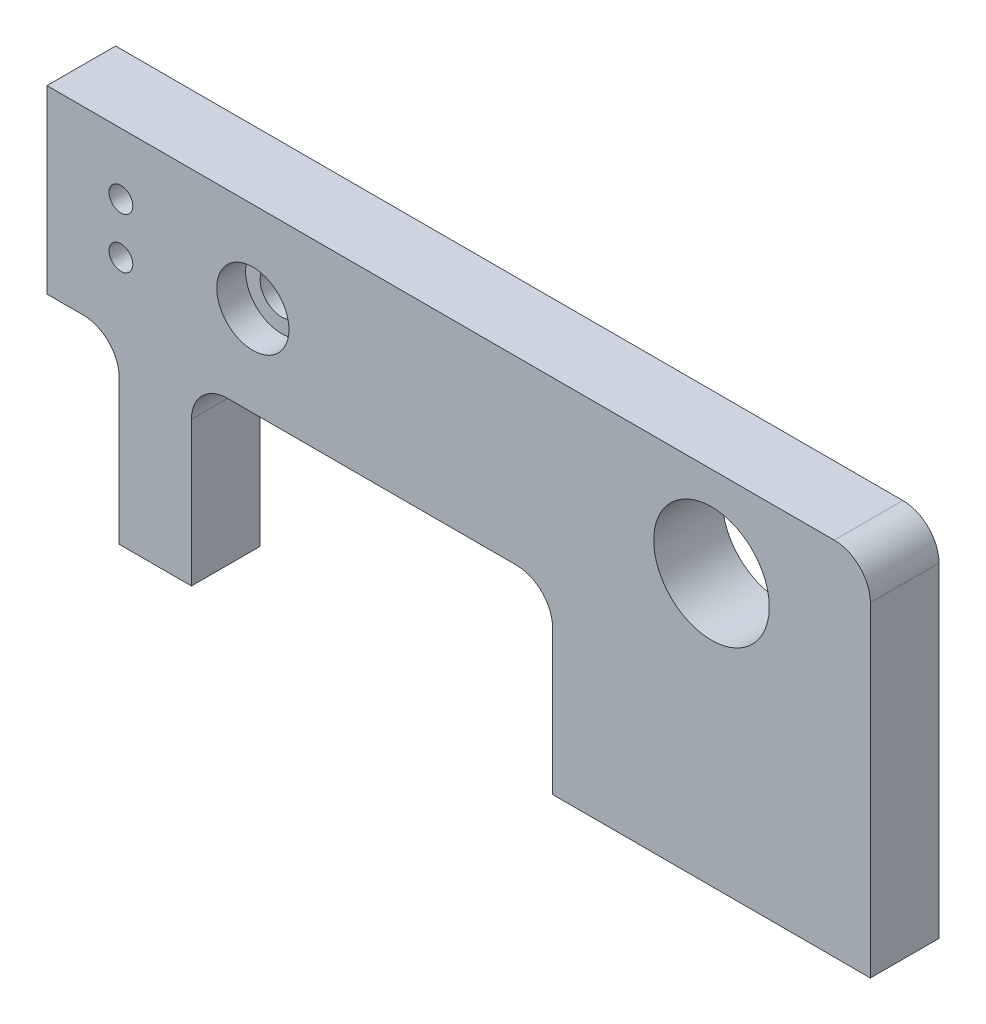
from build123d import *

# Parameters (mm, degrees)
SKETCH1_W             = 114
SKETCH1_H             = 50
BOSS_EXTRUDE1_DEPTH   = 4.75
SKETCH2_R             = 8
CUT_EXTRUDE1_DEPTH    = 63.962290301
FILLET1_R             = 5
SKETCH3_R             = 5
CUT_EXTRUDE2_DEPTH    = 4
SKETCH4_R             = 3
CUT_EXTRUDE3_DEPTH    = 63.483997951
M4_TAPPED_HOLE1_D     = 3.3
M4_TAPPED_HOLE2_D     = 3.3
M4_TAPPED_HOLE2_DEPTH = 14.1
M4_TAPPED_HOLE2_TIP   = 0.991420021


with BuildPart() as part:
    # Sketch1 → Boss-Extrude1 (new, symmetric)
    with BuildSketch(Plane.XY):
        Rectangle(SKETCH1_W, SKETCH1_H)
    extrude(amount=BOSS_EXTRUDE1_DEPTH, both=True)

    # Sketch2 → Cut-Extrude1 (cut, through all)
    with BuildSketch(Plane.XY.offset(4.75)):
        with BuildLine():
            Line((-37, -5), (-37, -25))
            Line((-37, -25), (13, -25))
            Line((13, -25), (13, -5))
            ThreePointArc((13, -5), (11.535533906, -1.464466094), (8, 0))
            Line((8, 0), (-32, 0))
            ThreePointArc((-32, 0), (-35.535533906, -1.464466094), (-37, -5))
        make_face()
        with BuildLine():
            Line((-57, -25), (-47, -25))
            Line((-47, -25), (-47, -5))
            ThreePointArc((-47, -5), (-48.464466094, -1.464466094), (-52, 0))
            Line((-52, 0), (-57, 0))
            Line((-57, 0), (-57, -25))
        make_face()
        with Locations((35, 12.5)):
            Circle(SKETCH2_R)
    extrude(amount=-CUT_EXTRUDE1_DEPTH, mode=Mode.SUBTRACT)

    # Fillet1
    fillet1_edges = [part.edges().sort_by_distance(p)[0] for p in [
        (57, 25, 0),
    ]]
    fillet(fillet1_edges, radius=FILLET1_R)

    # Sketch3 → Cut-Extrude2 (cut)
    with BuildSketch(Plane.XY.offset(4.75)):
        with Locations((-28.5, 12.5)):
            Circle(SKETCH3_R)
    extrude(amount=-CUT_EXTRUDE2_DEPTH, mode=Mode.SUBTRACT)

    # Sketch4 → Cut-Extrude3 (cut, through all)
    with BuildSketch(Plane.XY.offset(0.75)):
        with Locations((-28.5, 12.5)):
            Circle(SKETCH4_R)
    extrude(amount=-CUT_EXTRUDE3_DEPTH, mode=Mode.SUBTRACT)

    # M4 Tapped Hole1 (through all)
    with Locations(Plane.XY.offset(4.75)):
        with Locations((-46.77, 9.5), (-46.77, 16.5)):
            Hole(M4_TAPPED_HOLE1_D / 2)

    # M4 Tapped Hole2
    with Locations(Plane(origin=(0, -25, 0), x_dir=(-1, 0, 0), z_dir=(0, -1, 0))):
        with Locations((42, 0), (-21, 0), (-49, 0)):
            Hole(M4_TAPPED_HOLE2_D / 2, depth=M4_TAPPED_HOLE2_DEPTH)
            with Locations((0, 0, -(M4_TAPPED_HOLE2_DEPTH + M4_TAPPED_HOLE2_TIP / 2))):  # 118° drill point
                Cone(0, M4_TAPPED_HOLE2_D / 2, M4_TAPPED_HOLE2_TIP, mode=Mode.SUBTRACT)


solid = part.part
